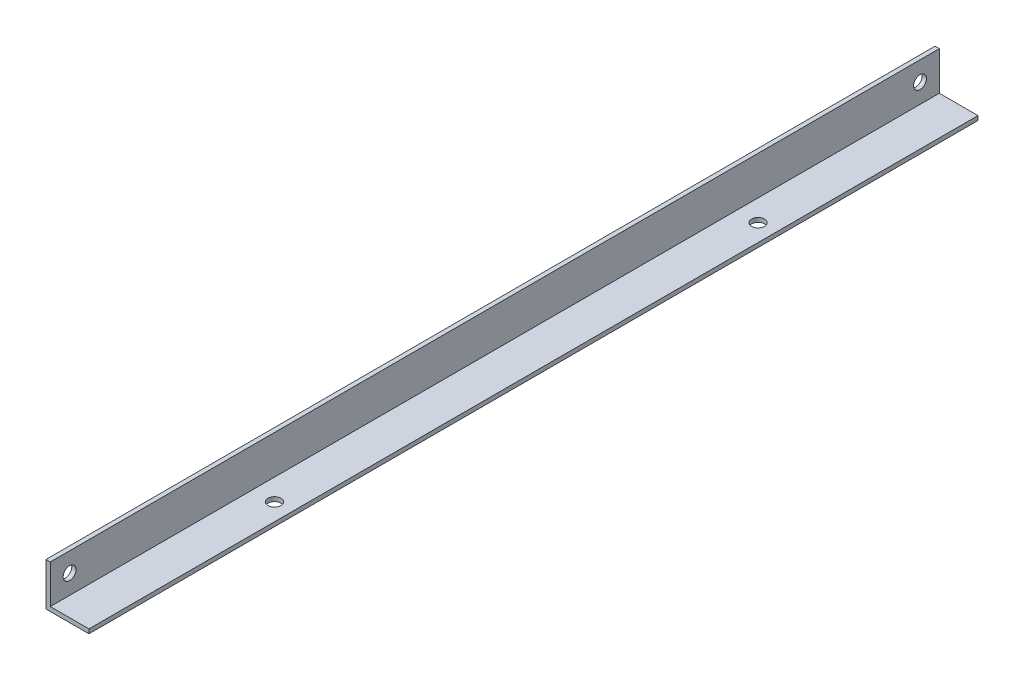
from build123d import *

# Parameters (mm, degrees)
EXTRU_MINCE1_DEPTH      = 103.5
ESQUISSE2_R             = 1.5
ENL_V_MAT_EXTRU_1_DEPTH = 3
ESQUISSE3_R             = 1.5
ENL_V_MAT_EXTRU_2_DEPTH = 3


with BuildPart() as part:
    # Esquisse1 → Extru.-Mince1 (new, symmetric)
    with BuildSketch(Plane.XY):
        Polygon((0, 10), (0, 0), (10, 0), (10, 1), (1, 1), (1, 10), align=None)
    extrude(amount=EXTRU_MINCE1_DEPTH, both=True)

    # Esquisse2 → Enlèv. mat.-Extru.1 (cut)
    with BuildSketch(Plane(origin=(0, 1, 0), x_dir=(1, 0, 0), z_dir=(0, 1, 0))):
        with Locations(Location((6, 56.3, 0), (0, 0, 270))):
            Circle(ESQUISSE2_R)
        with Locations(Location((6, -56.3, 0), (0, 0, 270))):
            Circle(ESQUISSE2_R)
    extrude(amount=-ENL_V_MAT_EXTRU_1_DEPTH, mode=Mode.SUBTRACT)

    # Esquisse3 → Enlèv. mat.-Extru.2 (cut)
    with BuildSketch(Plane(origin=(1, 0, 0), x_dir=(0, 0, -1), z_dir=(1, 0, 0))):
        with Locations(Location((-99, 5.5, 0), (0, 0, 90))):
            Circle(ESQUISSE3_R)
        with Locations(Location((99, 5.5, 0), (0, 0, 90))):
            Circle(ESQUISSE3_R)
    extrude(amount=-ENL_V_MAT_EXTRU_2_DEPTH, mode=Mode.SUBTRACT)


solid = part.part
